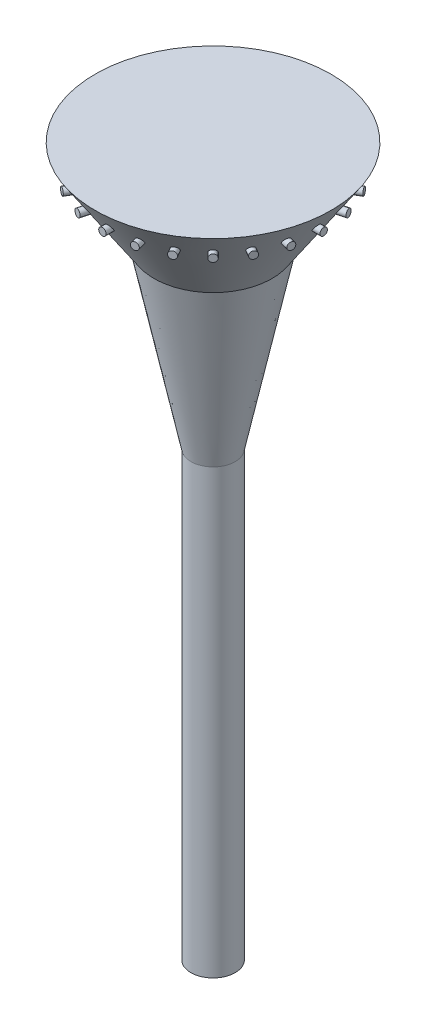
from build123d import *

# Parameters (mm, degrees)
SKETCH2_R           = 6.35
BOSS_EXTRUDE1_DEPTH = 190.5
CIRPATTERN1_COUNT   = 24


with BuildPart() as part:
    # Sketch1 → Revolve1 (revolve)
    with BuildSketch(Plane.XY, mode=Mode.PRIVATE) as revolve1_sk:
        Polygon((0, 0), (0, 1219.2), (-203.2, 1219.2), (-101.6, 1066.8), (-38.1, 762), (-38.1, 0), align=None)
    revolve(revolve1_sk.sketch.rotate(Axis((0, 0, 0), (0, 1, 0)), 270), axis=Axis((0, 0, 0), (0, 1, 0)))

    # Sketch2 → Boss-Extrude1 (add)
    with BuildSketch(Plane.XY):
        with Locations(Location((0, 1181.1, 0), (0, 0, 234.21258597))):
            Circle(SKETCH2_R)
    boss_extrude1 = extrude(amount=BOSS_EXTRUDE1_DEPTH)

    # CirPattern1: Boss-Extrude1 ×24 about axis
    cirpattern1_axis = Axis((0, 0, 0), (0, 1, 0))
    for i in range(1, CIRPATTERN1_COUNT):
        add(boss_extrude1.rotate(cirpattern1_axis, i * 360 / CIRPATTERN1_COUNT))


solid = part.part
